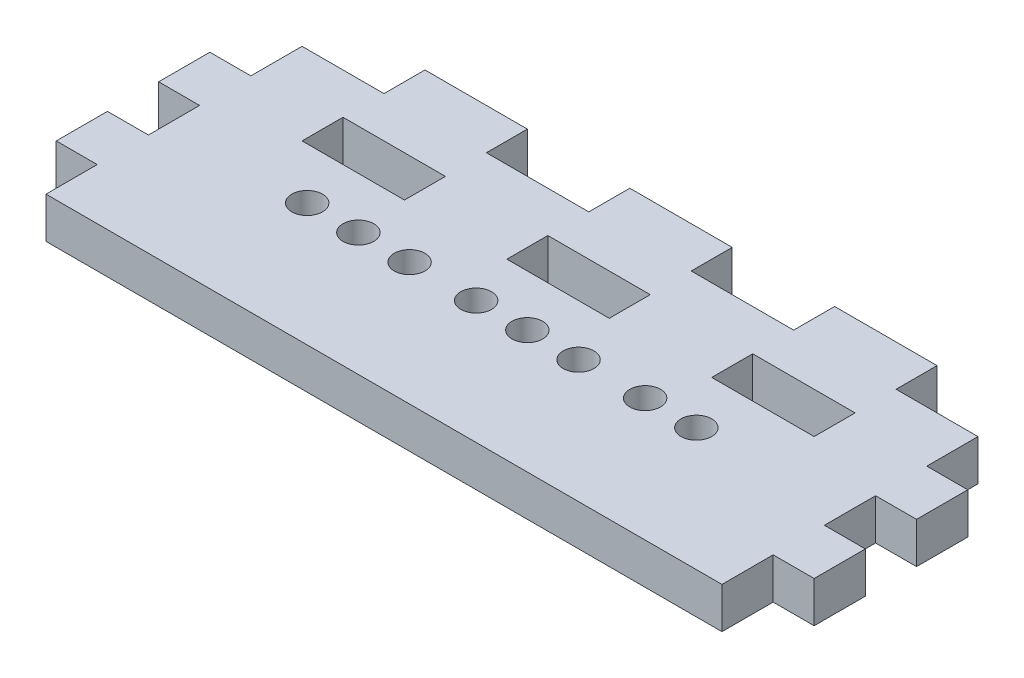
from build123d import *

# Parameters (mm, degrees)
SKETCH1_W           = 66
SKETCH1_H           = 25
BOSS_EXTRUDE1_DEPTH = 4
SKETCH2_W           = 4
SKETCH2_H           = 5
BOSS_EXTRUDE2_DEPTH = 4
LPATTERN1_COUNT     = 2
LPATTERN1_PITCH     = 10
SKETCH3_W           = 10
SKETCH3_H           = 4
BOSS_EXTRUDE3_DEPTH = 4
LPATTERN2_COUNT     = 2
LPATTERN2_PITCH     = 20
LPATTERN2_COL_COUNT = 2
LPATTERN2_COL_PITCH = 20
SKETCH4_W           = 10
SKETCH4_H           = 4
CUT_EXTRUDE1_DEPTH  = 75.437893576
SKETCH8_R           = 1.5
CUT_EXTRUDE4_DEPTH  = 75.437893576


with BuildPart() as part:
    # Sketch1 → Boss-Extrude1 (new body)
    with BuildSketch(Plane(origin=(0, 0, 0), x_dir=(1, 0, 0), z_dir=(0, 1, 0))):
        with Locations((33, -12.5)):
            Rectangle(SKETCH1_W, SKETCH1_H)
    extrude(amount=BOSS_EXTRUDE1_DEPTH)

    # Sketch2 → Boss-Extrude2 (add, through all)
    with BuildSketch(Plane(origin=(0, 4, 0), x_dir=(1, 0, 0), z_dir=(0, 1, 0))):
        with Locations((-2, -17.5)):
            Rectangle(SKETCH2_W, SKETCH2_H)
        with Locations((68, -17.5)):
            Rectangle(SKETCH2_W, SKETCH2_H)
    boss_extrude2 = extrude(amount=-BOSS_EXTRUDE2_DEPTH)

    # LPattern1: Boss-Extrude2 ×2
    with Locations(*[(0, 0, -i * LPATTERN1_PITCH) for i in range(1, LPATTERN1_COUNT)]):
        add(boss_extrude2)

    # Sketch3 → Boss-Extrude3 (add, through all)
    with BuildSketch(Plane(origin=(0, 4, 0), x_dir=(1, 0, 0), z_dir=(0, 1, 0))):
        with Locations((33, 2)):
            Rectangle(SKETCH3_W, SKETCH3_H)
    boss_extrude3 = extrude(amount=-BOSS_EXTRUDE3_DEPTH)

    # LPattern2: Boss-Extrude3 ×2
    with Locations(*[(i * LPATTERN2_PITCH, 0, 0) for i in range(1, LPATTERN2_COUNT)]):
        add(boss_extrude3)

    # LPattern2 col: Boss-Extrude3 ×2
    with Locations(*[(-i * LPATTERN2_COL_PITCH, 0, 0) for i in range(1, LPATTERN2_COL_COUNT)]):
        add(boss_extrude3)

    # Sketch4 → Cut-Extrude1 (cut, through all)
    with BuildSketch(Plane.XZ):
        with Locations((13, 6)):
            Rectangle(SKETCH4_W, SKETCH4_H)
        with Locations((33, 6)):
            Rectangle(SKETCH4_W, SKETCH4_H)
        with Locations((53, 6)):
            Rectangle(SKETCH4_W, SKETCH4_H)
    extrude(amount=-CUT_EXTRUDE1_DEPTH, mode=Mode.SUBTRACT)

    # Sketch8 → Cut-Extrude4 (cut, through all)
    with BuildSketch(Plane(origin=(0, 4, 0), x_dir=(1, 0, 0), z_dir=(0, 1, 0))):
        with Locations(Location((51.5, -13, 0), (0, 0, 270))):
            Circle(SKETCH8_R)
        with Locations(Location((46.5, -13, 0), (0, 0, 270))):
            Circle(SKETCH8_R)
        with Locations(Location((40, -13, 0), (0, 0, 270))):
            Circle(SKETCH8_R)
        with Locations(Location((35, -13, 0), (0, 0, 270))):
            Circle(SKETCH8_R)
        with Locations(Location((30, -13, 0), (0, 0, 270))):
            Circle(SKETCH8_R)
        with Locations(Location((23.5, -13, 0), (0, 0, 270))):
            Circle(SKETCH8_R)
        with Locations(Location((18.5, -13, 0), (0, 0, 270))):
            Circle(SKETCH8_R)
        with Locations(Location((13.5, -13, 0), (0, 0, 270))):
            Circle(SKETCH8_R)
    extrude(amount=-CUT_EXTRUDE4_DEPTH, mode=Mode.SUBTRACT)


solid = part.part
